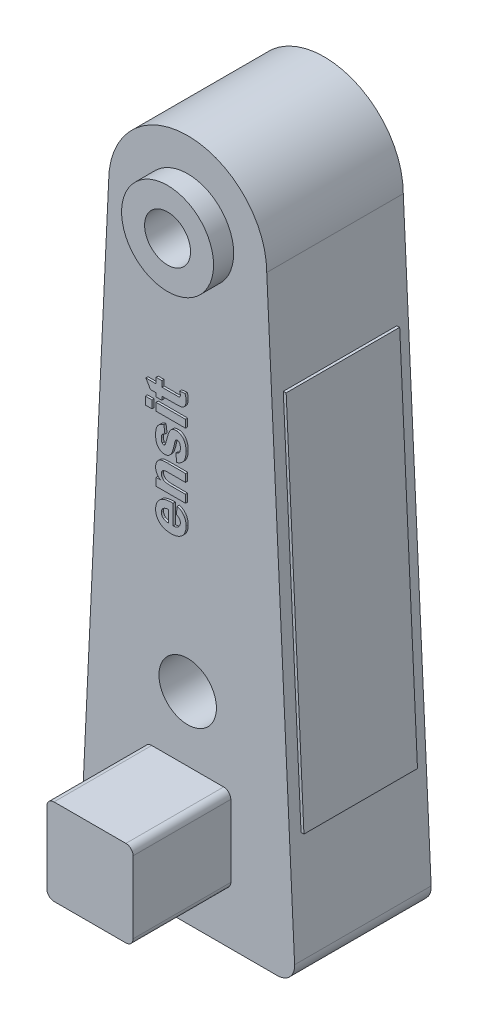
from build123d import *

# Parameters (mm, degrees)
BOSS_EXTRU_1_DEPTH      = 95
ESQUISSE2_R             = 20
ESQUISSE2_R_2           = 16
ENL_V_MAT_EXTRU_1_DEPTH = 357.072448119
BOSS_EXTRU_2_START      = 14
ESQUISSE3_R             = 32
ESQUISSE3_R_2           = 16
BOSS_EXTRU_2_DEPTH      = 14
BOSS_EXTRU_3_DEPTH      = 68
ESQUISSE5_W             = 79
ESQUISSE5_H             = 259.989629167
BOSS_EXTRU_4_DEPTH      = 2
ESQUISSE6_W             = 4.666666667
ESQUISSE6_H             = 5.384615385
ESQUISSE6_W_2           = 20.461538462
BOSS_EXTRU_5_DEPTH      = 1.5


with BuildPart() as part:
    # Esquisse1 → Boss.-Extru.1 (new body)
    with BuildSketch(Plane.XY):
        with BuildLine():
            Line((-62.41497369, -140), (62.41497369, -140))
            ThreePointArc((62.41497369, -140), (71.099712648, -136.281021027), (74.401391343, -127.429218207))
            Line((74.401391343, -127.429218207), (55, 280))
            ThreePointArc((55, 280), (0, 335), (-55, 280))
            Line((-55, 280), (-74.401391343, -127.429218207))
            ThreePointArc((-74.401391343, -127.429218207), (-71.099712648, -136.281021027), (-62.41497369, -140))
        make_face()
    extrude(amount=BOSS_EXTRU_1_DEPTH)

    # Esquisse2 → Enlèv. mat.-Extru.1 (cut, through all)
    with BuildSketch(Plane.XY.offset(95)):
        Circle(ESQUISSE2_R)
        with Locations((0, 280)):
            Circle(ESQUISSE2_R_2)
    extrude(amount=-ENL_V_MAT_EXTRU_1_DEPTH, mode=Mode.SUBTRACT)

    # Esquisse3 → Boss.-Extru.2 (add)
    with BuildSketch(Plane.XY.offset(95).offset(BOSS_EXTRU_2_START)):
        with Locations((0, 280)):
            Circle(ESQUISSE3_R)
        with Locations((0, 280)):
            Circle(ESQUISSE3_R_2, mode=Mode.SUBTRACT)
    extrude(amount=-BOSS_EXTRU_2_DEPTH)

    # Esquisse4 → Boss.-Extru.3 (add)
    with BuildSketch(Plane.XY.offset(95)):
        with BuildLine():
            Line((-25, -105), (25, -105))
            ThreePointArc((25, -105), (28.535533906, -103.535533906), (30, -100))
            Line((30, -100), (30, -50))
            ThreePointArc((30, -50), (28.535533906, -46.464466094), (25, -45))
            Line((25, -45), (-25, -45))
            ThreePointArc((-25, -45), (-28.535533906, -46.464466094), (-30, -50))
            Line((-30, -50), (-30, -100))
            ThreePointArc((-30, -100), (-28.535533906, -103.535533906), (-25, -105))
        make_face()
    extrude(amount=BOSS_EXTRU_3_DEPTH)

    # Esquisse5 → Boss.-Extru.4 (add)
    with BuildSketch(Plane(origin=(68.178733032, 3.246606335, 0), x_dir=(0, 0, -1), z_dir=(0.9988681377244376, 0.04756514941544941, 0))):
        with Locations((-47.5, 73.121548084)):
            Rectangle(ESQUISSE5_W, ESQUISSE5_H)
    extrude(amount=BOSS_EXTRU_4_DEPTH)

    # Esquisse6 → Boss.-Extru.5 (add)
    # profile 1 of 6: a face of its own
    with BuildSketch(Plane.XY.offset(95)):
        with BuildLine():
            Line((-6.461538462, 104.128205128), (-5.743589744, 109.512820513))
            add(Edge.make_bspline(
                [(-5.743589744, 109.512820513), (-5.501006608, 109.424715693), (-5.024036452, 109.251482835), (-4.343564179, 108.935553813), (-3.708516069, 108.579486741), (-3.111635493, 108.19601677), (-2.564328757, 107.7667827), (-2.065430868, 107.297813624), (-1.601117702, 106.800795615), (-1.192712025, 106.258370252), (-0.825760115, 105.683401604), (-0.503719714, 105.073544301), (-0.244762206, 104.421907477), (-0.014437692, 103.744756773), (0.148869701, 103.02781979), (0.274317456, 102.279038677), (0.347697727, 101.493459881), (0.355168117, 100.957415246), (0.358974359, 100.684294872)],
                knots=[0, 0, 0, 0, 1.071107943, 2.106026551, 3.110246261, 4.091985686, 5.048484327, 5.993098568, 6.93243604, 7.868560994, 8.807385201, 9.762150055, 10.726459026, 11.715657284, 12.728568854, 13.774950884, 14.866314096, 16, 16, 16, 16], degree=3))
            add(Edge.make_bspline(
                [(0.358974359, 100.684294872), (0.347561631, 100.257613776), (0.325405615, 99.429279505), (0.173009394, 98.227988636), (-0.106361577, 97.116720063), (-0.477944019, 96.084699741), (-0.972094859, 95.143526998), (-1.562136001, 94.278954402), (-2.274777645, 93.509777825), (-2.821049856, 93.073750879), (-3.096153846, 92.854166667)],
                knots=[0, 0, 0, 0, 1.150789362, 2.234076637, 3.257711293, 4.235652307, 5.185165037, 6.116713503, 7.051572421, 8, 8, 8, 8], degree=3))
            add(Edge.make_bspline(
                [(-3.096153846, 92.854166667), (-3.330681354, 92.69242529), (-3.802951289, 92.366725374), (-4.56819468, 91.961868412), (-5.376592097, 91.615681853), (-6.230459128, 91.339887846), (-7.126551504, 91.110626603), (-8.070562071, 90.956376519), (-9.060509753, 90.867471465), (-9.73512681, 90.853355852), (-10.079326923, 90.846153846)],
                knots=[0, 0, 0, 0, 0.92479112, 1.862259343, 2.806490716, 3.778329015, 4.774107667, 5.808532634, 6.881879269, 8, 8, 8, 8], degree=3))
            add(Edge.make_bspline(
                [(-10.079326923, 90.846153846), (-10.487348705, 90.852068643), (-11.284987436, 90.863631435), (-12.444419657, 91.000834439), (-13.541045657, 91.193863509), (-14.564113096, 91.490786112), (-15.525594941, 91.854675724), (-16.407950297, 92.324255132), (-17.236697824, 92.852182926), (-17.97752343, 93.479223487), (-18.645830859, 94.160164391), (-19.224209579, 94.894324148), (-19.725571493, 95.663711279), (-20.12236037, 96.485735652), (-20.44226999, 97.346302743), (-20.655660284, 98.256767629), (-20.796310841, 99.206619363), (-20.81236088, 99.855516316), (-20.820512821, 100.185096154)],
                knots=[0, 0, 0, 0, 1.22195635, 2.388793332, 3.494217055, 4.554658532, 5.576328032, 6.568651924, 7.544518331, 8.515047117, 9.469844265, 10.399052018, 11.311283086, 12.215791516, 13.128572929, 14.056648418, 15.012956531, 16, 16, 16, 16], degree=3))
            add(Edge.make_bspline(
                [(-20.820512821, 100.185096154), (-20.812715371, 100.553888077), (-20.79745658, 101.275575215), (-20.654212601, 102.32779459), (-20.421213661, 103.321262658), (-20.086439313, 104.252771613), (-19.666537743, 105.128260544), (-19.146561404, 105.941713338), (-18.530273207, 106.690278619), (-17.824380481, 107.380469141), (-17.021181493, 108.001560192), (-16.109209922, 108.527346064), (-15.103063355, 108.971879004), (-13.998123454, 109.330447851), (-12.791665476, 109.595885921), (-11.486517644, 109.777411653), (-10.08289133, 109.880958236), (-9.114752768, 109.874913012), (-8.615384615, 109.871794872)],
                knots=[0, 0, 0, 0, 0.994896733, 1.946908626, 2.859956003, 3.744186721, 4.613079774, 5.475353993, 6.343074053, 7.224463735, 8.134843929, 9.075595858, 10.058286387, 11.098708908, 12.205400254, 13.387874146, 14.652659326, 16, 16, 16, 16], degree=3))
            Line((-8.615384615, 109.871794872), (-8.615384615, 96.230769231))
            add(Edge.make_bspline(
                [(-8.615384615, 96.230769231), (-8.422655443, 96.239599959), (-8.047349924, 96.25679622), (-7.498754662, 96.321934164), (-6.985244151, 96.434699071), (-6.503702991, 96.582271818), (-6.053793278, 96.757750185), (-5.639835272, 96.980972555), (-5.256547966, 97.238153423), (-4.910181652, 97.535470716), (-4.602710213, 97.8610089), (-4.332501073, 98.204524985), (-4.096224632, 98.565491695), (-3.91652132, 98.953234857), (-3.764782142, 99.354863173), (-3.667519517, 99.777606746), (-3.602888703, 100.21863603), (-3.59418527, 100.519523194), (-3.58974359, 100.673076923)],
                knots=[0, 0, 0, 0, 1.231756261, 2.398624542, 3.522625857, 4.583815436, 5.612473245, 6.600564899, 7.580690863, 8.554470542, 9.508734211, 10.435415665, 11.342824763, 12.255949018, 13.158633635, 14.07945191, 15.019874036, 16, 16, 16, 16], degree=3))
            add(Edge.make_bspline(
                [(-3.58974359, 100.673076923), (-3.59897057, 100.877384878), (-3.616841854, 101.273098903), (-3.737723011, 101.84537841), (-3.96305339, 102.360208335), (-4.263180606, 102.832292966), (-4.664698251, 103.248345587), (-5.171003462, 103.603003106), (-5.775665559, 103.907543962), (-6.225391847, 104.052231304), (-6.461538462, 104.128205128)],
                knots=[0, 0, 0, 0, 1.004921032, 1.946382099, 2.856706549, 3.754452914, 4.684394026, 5.679508242, 6.781533818, 8, 8, 8, 8], degree=3))
        make_face()
        with BuildLine():
            add(Edge.make_bspline(
                [(-11.846153846, 104.487179487), (-12.044453586, 104.477919999), (-12.430656174, 104.4598865), (-12.993687781, 104.400905265), (-13.518660513, 104.30021392), (-14.009248228, 104.165536853), (-14.458953883, 103.99237507), (-14.876640828, 103.790205694), (-15.253004646, 103.546688823), (-15.593979345, 103.274744835), (-15.893320848, 102.972683258), (-16.156497645, 102.656741765), (-16.376022372, 102.322565641), (-16.56012553, 101.976462033), (-16.698919426, 101.61052298), (-16.801548866, 101.22937987), (-16.856415468, 100.831698964), (-16.866611715, 100.562915402), (-16.871794872, 100.426282051)],
                knots=[0, 0, 0, 0, 1.316843738, 2.564645129, 3.751729234, 4.859162073, 5.934884982, 6.944432334, 7.931870412, 8.902336615, 9.831997632, 10.748324706, 11.625538792, 12.479920341, 13.343703281, 14.216169456, 15.093208151, 16, 16, 16, 16], degree=3))
            add(Edge.make_bspline(
                [(-16.871794872, 100.426282051), (-16.867055061, 100.280263387), (-16.857715026, 99.992526314), (-16.796773029, 99.570568468), (-16.688681768, 99.170614229), (-16.542385714, 98.789615535), (-16.349729134, 98.428388879), (-16.113459601, 98.086926185), (-15.836535181, 97.763942842), (-15.626734666, 97.569330575), (-15.520032051, 97.470352564)],
                knots=[0, 0, 0, 0, 1.043516863, 2.056302107, 3.038302912, 3.998520634, 4.966791607, 5.956307719, 6.960596886, 8, 8, 8, 8], degree=3))
            add(Edge.make_bspline(
                [(-15.520032051, 97.470352564), (-15.404030882, 97.37809841), (-15.170970074, 97.192748315), (-14.784545983, 96.957669745), (-14.371503886, 96.752899985), (-13.920692054, 96.600302013), (-13.446720326, 96.466290032), (-12.938261367, 96.387679429), (-12.402589622, 96.334723766), (-12.035135588, 96.329043274), (-11.846153846, 96.326121795)],
                knots=[0, 0, 0, 0, 0.903873942, 1.815995408, 2.755131859, 3.711650387, 4.716574161, 5.757841734, 6.846857195, 8, 8, 8, 8], degree=3))
            Line((-11.846153846, 96.326121795), (-11.846153846, 104.487179487))
        make_face(mode=Mode.SUBTRACT)
    # profile 2 of 6: a face of its own
    with BuildSketch(Plane.XY.offset(95)):
        with BuildLine():
            Line((0, 132.128205128), (0, 126.743589744))
            Line((0, 126.743589744), (-10.5, 126.743589744))
            add(Edge.make_bspline(
                [(-10.5, 126.743589744), (-10.765507463, 126.742802233), (-11.272274602, 126.741299133), (-11.995808782, 126.722260708), (-12.644846107, 126.702782443), (-13.220907928, 126.669049557), (-13.722470235, 126.626254977), (-14.153077782, 126.570905504), (-14.509077024, 126.505874818), (-14.880449528, 126.411317264), (-15.272232329, 126.258407347), (-15.682620514, 126.021708207), (-16.045512216, 125.739395428), (-16.341290421, 125.400027044), (-16.581954441, 125.021063241), (-16.749474291, 124.600655066), (-16.854370246, 124.144276441), (-16.865868723, 123.827516364), (-16.871794872, 123.664262821)],
                knots=[0, 0, 0, 0, 1.584493052, 3.024280373, 4.319392181, 5.459488321, 6.467679107, 7.323005985, 8.049570451, 8.626025587, 9.608194156, 10.547930895, 11.445379944, 12.338657376, 13.220996304, 14.11197102, 15.026937278, 16, 16, 16, 16], degree=3))
            add(Edge.make_bspline(
                [(-16.871794872, 123.664262821), (-16.86213041, 123.453945788), (-16.843078352, 123.039336881), (-16.689696256, 122.435216176), (-16.448608326, 121.863851898), (-16.10941893, 121.336354579), (-15.692760055, 120.866394117), (-15.200471906, 120.47527696), (-14.652482824, 120.156519656), (-14.137882602, 119.963465214), (-13.671729421, 119.847438985), (-13.250529875, 119.768698075), (-12.759113188, 119.712222292), (-12.202407332, 119.652598119), (-11.575196301, 119.618959427), (-10.883681247, 119.581427855), (-10.122379198, 119.567609098), (-9.59321361, 119.56530658), (-9.31650641, 119.564102564)],
                knots=[0, 0, 0, 0, 1.032566677, 2.035552408, 3.044331183, 4.069139801, 5.103993993, 6.117241679, 7.146531659, 8.208133594, 8.805465577, 9.506599874, 10.312470975, 11.236026688, 12.25811227, 13.398971111, 14.639889977, 16, 16, 16, 16], degree=3))
            Line((-9.31650641, 119.564102564), (0, 119.564102564))
            Line((0, 119.564102564), (0, 114.179487179))
            Line((0, 114.179487179), (-20.461538462, 114.179487179))
            Line((-20.461538462, 114.179487179), (-20.461538462, 119.564102564))
            Line((-20.461538462, 119.564102564), (-17.511217949, 119.564102564))
            add(Edge.make_bspline(
                [(-17.511217949, 119.564102564), (-17.773571188, 119.772247802), (-18.284659152, 120.177733651), (-18.963025136, 120.85711677), (-19.541399563, 121.573906117), (-20.002409043, 122.341527023), (-20.37537061, 123.141978998), (-20.628736907, 123.988689157), (-20.794894322, 124.873029841), (-20.811872425, 125.477057128), (-20.820512821, 125.784455128)],
                knots=[0, 0, 0, 0, 1.096351489, 2.135792388, 3.138267738, 4.105721302, 5.062255615, 6.023231078, 6.993994435, 8, 8, 8, 8], degree=3))
            add(Edge.make_bspline(
                [(-20.820512821, 125.784455128), (-20.813906022, 126.054244923), (-20.800895316, 126.585539349), (-20.670260563, 127.360966725), (-20.478339698, 128.104611492), (-20.194685853, 128.799115269), (-19.862300766, 129.441916426), (-19.462690954, 129.997982081), (-19.038171972, 130.487187932), (-18.552470151, 130.880896777), (-18.030456476, 131.205860183), (-17.479550392, 131.483480066), (-16.892604508, 131.702278898), (-16.25570326, 131.869427897), (-15.532214565, 131.983587877), (-14.693762576, 132.072997568), (-13.718195988, 132.119575613), (-13.024078164, 132.125203368), (-12.653846154, 132.128205128)],
                knots=[0, 0, 0, 0, 1.087198529, 2.141009522, 3.163542844, 4.178792496, 5.160466844, 6.074805919, 6.934654979, 7.765030839, 8.585173683, 9.411430249, 10.24903402, 11.106896671, 12.062742222, 13.200321845, 14.506693772, 16, 16, 16, 16], degree=3))
            Line((-12.653846154, 132.128205128), (0, 132.128205128))
        make_face()
    # profile 3 of 6: a face of its own
    with BuildSketch(Plane.XY.offset(95)):
        with BuildLine():
            Line((-6.102564103, 135.717948718), (-6.820512821, 141.102564103))
            add(Edge.make_bspline(
                [(-6.820512821, 141.102564103), (-6.569092778, 141.167291309), (-6.084794987, 141.291972072), (-5.426541749, 141.605176652), (-4.860918311, 142.004235511), (-4.392569329, 142.499847615), (-4.026055718, 143.099125241), (-3.77140452, 143.802573816), (-3.612773296, 144.608617665), (-3.59769153, 145.181349247), (-3.58974359, 145.483173077)],
                knots=[0, 0, 0, 0, 1.03977575, 2.002867763, 2.906350581, 3.803237518, 4.719339767, 5.704501652, 6.79029527, 8, 8, 8, 8], degree=3))
            add(Edge.make_bspline(
                [(-3.58974359, 145.483173077), (-3.596539376, 145.812946048), (-3.609315034, 146.432898854), (-3.749299584, 147.296128258), (-3.971173984, 148.040938015), (-4.22263654, 148.452395245), (-4.341346154, 148.646634615)],
                knots=[0, 0, 0, 0, 1.198129151, 2.252408761, 3.175002897, 4, 4, 4, 4], degree=3))
            add(Edge.make_bspline(
                [(-4.341346154, 148.646634615), (-4.431206843, 148.757326627), (-4.605966949, 148.972599267), (-4.957581795, 149.191056108), (-5.343520115, 149.336467224), (-5.61878685, 149.351328142), (-5.760416667, 149.358974359)],
                knots=[0, 0, 0, 0, 1.030872991, 2.004830756, 2.973448591, 4, 4, 4, 4], degree=3))
            add(Edge.make_bspline(
                [(-5.760416667, 149.358974359), (-5.856262429, 149.3553091), (-6.043472585, 149.348149954), (-6.311191282, 149.273237703), (-6.553160424, 149.147504476), (-6.689786774, 149.030877986), (-6.758814103, 148.971955128)],
                knots=[0, 0, 0, 0, 1.045349703, 2.041822997, 3.010676005, 4, 4, 4, 4], degree=3))
            add(Edge.make_bspline(
                [(-6.758814103, 148.971955128), (-6.824173485, 148.886230299), (-6.975623627, 148.687589535), (-7.135578647, 148.284157434), (-7.312037995, 147.771495523), (-7.403964775, 147.380223837), (-7.454326923, 147.165865385)],
                knots=[0, 0, 0, 0, 0.660501868, 1.530508677, 2.647087544, 4, 4, 4, 4], degree=3))
            add(Edge.make_bspline(
                [(-7.454326923, 147.165865385), (-7.568001857, 146.643718121), (-7.784414075, 145.649663902), (-8.128711019, 144.236390075), (-8.461974957, 142.973626517), (-8.786801465, 141.858213919), (-9.100532395, 140.894013878), (-9.417584697, 140.080957466), (-9.713111762, 139.410773098), (-9.94318453, 139.032907768), (-10.045673077, 138.864583333)],
                knots=[0, 0, 0, 0, 1.469089687, 2.796825535, 3.998745421, 5.059265209, 5.990657066, 6.784841839, 7.458693894, 8, 8, 8, 8], degree=3))
            add(Edge.make_bspline(
                [(-10.045673077, 138.864583333), (-10.18564756, 138.67255827), (-10.458942984, 138.297635853), (-10.929522907, 137.798241694), (-11.441171254, 137.374792481), (-11.995470073, 137.028568148), (-12.591092062, 136.764306253), (-13.225272664, 136.571070611), (-13.90069646, 136.459172387), (-14.364176313, 136.443749901), (-14.600160256, 136.435897436)],
                knots=[0, 0, 0, 0, 1.056974227, 2.063706289, 3.045111424, 4.005796011, 4.963194591, 5.937303459, 6.949763919, 8, 8, 8, 8], degree=3))
            add(Edge.make_bspline(
                [(-14.600160256, 136.435897436), (-14.815491005, 136.442765851), (-15.240800558, 136.456331969), (-15.864260371, 136.551680033), (-16.460646091, 136.716372986), (-17.031034171, 136.94792356), (-17.575386261, 137.247170037), (-18.096202993, 137.607889435), (-18.583374417, 138.038442877), (-19.048090319, 138.527038947), (-19.468053274, 139.088336165), (-19.836145162, 139.721339284), (-20.137008984, 140.431694745), (-20.387005979, 141.209070748), (-20.584127653, 142.058871631), (-20.720784359, 142.979775133), (-20.805724897, 143.972761303), (-20.815482121, 144.658474358), (-20.820512821, 145.012019231)],
                knots=[0, 0, 0, 0, 0.866467056, 1.711398476, 2.531025161, 3.351204248, 4.182899032, 5.026153667, 5.89536065, 6.794911284, 7.735444051, 8.709799683, 9.7343434, 10.83365844, 11.992614653, 13.240848695, 14.577416907, 16, 16, 16, 16], degree=3))
            add(Edge.make_bspline(
                [(-20.820512821, 145.012019231), (-20.816509498, 145.348686443), (-20.808738968, 146.002164387), (-20.740513164, 146.947625979), (-20.633046066, 147.827237435), (-20.467002975, 148.637347724), (-20.270382217, 149.38368649), (-20.023118146, 150.064631291), (-19.727069021, 150.674954458), (-19.38630137, 151.225418466), (-18.993213376, 151.713395864), (-18.566434765, 152.167060389), (-18.090012126, 152.576133245), (-17.577305107, 152.95602244), (-17.009330414, 153.277119447), (-16.408008871, 153.57200756), (-15.760795931, 153.825662823), (-15.308019319, 153.958063828), (-15.076923077, 154.025641026)],
                knots=[0, 0, 0, 0, 1.380360088, 2.679307166, 3.885113103, 5.011294146, 6.067668824, 7.047577368, 7.976808132, 8.844746588, 9.6960693, 10.542058856, 11.395278188, 12.26784334, 13.154143679, 14.066232085, 15.013008876, 16, 16, 16, 16], degree=3))
            Line((-15.076923077, 154.025641026), (-14.358974359, 148.641025641))
            add(Edge.make_bspline(
                [(-14.358974359, 148.641025641), (-14.552047053, 148.587677071), (-14.926852522, 148.484113303), (-15.434568038, 148.22615665), (-15.87626475, 147.910301821), (-16.243125527, 147.522025762), (-16.533014556, 147.05225252), (-16.728739725, 146.494019804), (-16.854738417, 145.851480986), (-16.86589524, 145.394101762), (-16.871794872, 145.15224359)],
                knots=[0, 0, 0, 0, 1.018088462, 1.976380579, 2.883123771, 3.772444965, 4.678988082, 5.673279403, 6.769650299, 8, 8, 8, 8], degree=3))
            add(Edge.make_bspline(
                [(-16.871794872, 145.15224359), (-16.864400999, 144.852669733), (-16.850667362, 144.29623084), (-16.749715279, 143.529342043), (-16.576789704, 142.890025628), (-16.379066262, 142.541238398), (-16.288461538, 142.381410256)],
                knots=[0, 0, 0, 0, 1.253094045, 2.327540427, 3.233612691, 4, 4, 4, 4], degree=3))
            add(Edge.make_bspline(
                [(-16.288461538, 142.381410256), (-16.217521119, 142.29511266), (-16.081390467, 142.129512454), (-15.817582577, 141.950725243), (-15.525231463, 141.837166465), (-15.317289639, 141.826127044), (-15.211538462, 141.820512821)],
                knots=[0, 0, 0, 0, 1.057832138, 2.029920023, 2.998093444, 4, 4, 4, 4], degree=3))
            add(Edge.make_bspline(
                [(-15.211538462, 141.820512821), (-15.120949105, 141.827336144), (-14.940275072, 141.840944779), (-14.680901039, 141.941376946), (-14.443744645, 142.10907445), (-14.318171788, 142.262035245), (-14.252403846, 142.342147436)],
                knots=[0, 0, 0, 0, 0.958252903, 1.911167308, 2.905987877, 4, 4, 4, 4], degree=3))
            add(Edge.make_bspline(
                [(-14.252403846, 142.342147436), (-14.203592579, 142.417689951), (-14.086974952, 142.598172642), (-13.945594958, 142.945727771), (-13.7825968, 143.396878571), (-13.606695462, 143.957536762), (-13.408077872, 144.623436129), (-13.210372338, 145.401707441), (-12.991249209, 146.285975987), (-12.764874451, 147.250593421), (-12.532555629, 148.232771445), (-12.268074372, 149.161972838), (-11.994116648, 150.014323763), (-11.705116212, 150.786075037), (-11.400459709, 151.480183985), (-11.090662319, 152.098165339), (-10.762025537, 152.638206661), (-10.512472674, 152.950965961), (-10.393429487, 153.100160256)],
                knots=[0, 0, 0, 0, 0.374470902, 0.894668607, 1.558240068, 2.377002728, 3.344280683, 4.45643205, 5.72551034, 7.144099038, 8.589083829, 9.934452683, 11.172410737, 12.322411392, 13.369942356, 14.332493707, 15.20455626, 16, 16, 16, 16], degree=3))
            add(Edge.make_bspline(
                [(-10.393429487, 153.100160256), (-10.271486206, 153.232688475), (-10.030535251, 153.494554487), (-9.612165948, 153.824331642), (-9.169499017, 154.116673964), (-8.683759373, 154.343020145), (-8.167673967, 154.525555159), (-7.61495981, 154.654908363), (-7.026114431, 154.725033143), (-6.622502661, 154.737322404), (-6.416666667, 154.743589744)],
                knots=[0, 0, 0, 0, 0.971012965, 1.9186502, 2.868006896, 3.82989672, 4.803792202, 5.820095146, 6.888280979, 8, 8, 8, 8], degree=3))
            add(Edge.make_bspline(
                [(-6.416666667, 154.743589744), (-6.188212069, 154.735238584), (-5.738160138, 154.718786932), (-5.074207049, 154.612180375), (-4.438544333, 154.422382972), (-3.821542712, 154.172644029), (-3.235191915, 153.835590992), (-2.673840019, 153.428665018), (-2.13092088, 152.955679575), (-1.62151804, 152.406332807), (-1.156320253, 151.782802929), (-0.744247904, 151.090996541), (-0.402345981, 150.325778653), (-0.122387817, 149.491514028), (0.093628857, 148.586448721), (0.251222169, 147.611790378), (0.337793686, 146.567274898), (0.351775999, 145.847907864), (0.358974359, 145.477564103)],
                knots=[0, 0, 0, 0, 0.853005228, 1.680406763, 2.502135431, 3.325285981, 4.159928718, 5.020072903, 5.910500533, 6.844018396, 7.811498054, 8.809909951, 9.84399402, 10.934451331, 12.090792638, 13.314110396, 14.617253208, 16, 16, 16, 16], degree=3))
            add(Edge.make_bspline(
                [(0.358974359, 145.477564103), (0.353097399, 145.139053993), (0.341651721, 144.479788317), (0.267168101, 143.517621426), (0.121110506, 142.612633603), (-0.055827924, 141.75652162), (-0.306230076, 140.959002993), (-0.602718172, 140.212711394), (-0.955427583, 139.520128683), (-1.366694746, 138.885600877), (-1.823632776, 138.305879297), (-2.318515608, 137.77610599), (-2.851366045, 137.298995835), (-3.423149262, 136.87330165), (-4.036588489, 136.50375697), (-4.687329243, 136.18397252), (-5.377874415, 135.916081062), (-5.858174063, 135.784765691), (-6.102564103, 135.717948718)],
                knots=[0, 0, 0, 0, 1.275882977, 2.484847063, 3.632911253, 4.72891361, 5.776434669, 6.778732445, 7.752511816, 8.700454148, 9.62377315, 10.531089817, 11.429331714, 12.315777555, 13.213660083, 14.124390551, 15.045636884, 16, 16, 16, 16], degree=3))
        make_face()
    # profile 4 of 6: a face of its own
    with BuildSketch(Plane.XY.offset(95)):
        with Locations((-25.666666666, 162.102564103)):
            Rectangle(ESQUISSE6_W, ESQUISSE6_H)
    # profile 5 of 6: a face of its own
    with BuildSketch(Plane.XY.offset(95)):
        with Locations((-10.230769231, 162.102564103)):
            Rectangle(ESQUISSE6_W_2, ESQUISSE6_H)
    # profile 6 of 6: a face of its own
    with BuildSketch(Plane.XY.offset(95)):
        with BuildLine():
            Line((-20.461538462, 179.871794872), (-16.512820513, 179.871794872))
            Line((-16.512820513, 179.871794872), (-16.512820513, 175.923076923))
            Line((-16.512820513, 175.923076923), (-7.717948718, 175.923076923))
            add(Edge.make_bspline(
                [(-7.717948718, 175.923076923), (-7.506676804, 175.922666092), (-7.108429247, 175.921891676), (-6.54561709, 175.926986284), (-6.052044348, 175.938886062), (-5.627711855, 175.951413786), (-5.273839086, 175.957259929), (-4.99169917, 175.982133779), (-4.778485338, 176.003707237), (-4.512404737, 176.038676636), (-4.187946772, 176.190559461), (-3.915701574, 176.460056098), (-3.744474482, 176.721882388), (-3.656291933, 176.951532495), (-3.597271659, 177.198929248), (-3.592288495, 177.371701159), (-3.58974359, 177.459935897)],
                knots=[0, 0, 0, 0, 1.77315728, 3.34240147, 4.723623899, 5.916602724, 6.905675159, 7.692764687, 8.292342073, 8.70512513, 9.941484344, 11.206586204, 11.8769341, 12.552951387, 13.260991239, 14, 14, 14, 14], degree=3))
            add(Edge.make_bspline(
                [(-3.58974359, 177.459935897), (-3.59790553, 177.604250626), (-3.615954518, 177.92338245), (-3.719652653, 178.441169585), (-3.884684158, 179.041285563), (-4.028560294, 179.46495301), (-4.105769231, 179.692307692)],
                knots=[0, 0, 0, 0, 0.753421026, 1.666085143, 2.747540144, 4, 4, 4, 4], degree=3))
            Line((-4.105769231, 179.692307692), (-0.353365385, 180.230769231))
            add(Edge.make_bspline(
                [(-0.353365385, 180.230769231), (-0.241188492, 179.903782785), (-0.012990561, 179.238604526), (0.194620796, 178.179086978), (0.33563488, 177.061812156), (0.351072833, 176.293752786), (0.358974359, 175.900641026)],
                knots=[0, 0, 0, 0, 0.939547081, 1.911291127, 2.930947196, 4, 4, 4, 4], degree=3))
            add(Edge.make_bspline(
                [(0.358974359, 175.900641026), (0.351800641, 175.659206991), (0.337791769, 175.187733429), (0.248993296, 174.497344522), (0.091556762, 173.845246536), (-0.125476871, 173.236179984), (-0.392044984, 172.685989139), (-0.69169444, 172.201885845), (-1.039792907, 171.802141333), (-1.429249439, 171.473877409), (-1.874432039, 171.211554276), (-2.37954042, 171.001237405), (-2.949917778, 170.824092647), (-3.358713814, 170.750763232), (-3.572916667, 170.712339744)],
                knots=[0, 0, 0, 0, 1.203161335, 2.349539328, 3.461321991, 4.539895401, 5.564950711, 6.503172023, 7.368227033, 8.19490246, 9.030559212, 9.932169365, 10.916488464, 12, 12, 12, 12], degree=3))
            add(Edge.make_bspline(
                [(-3.572916667, 170.712339744), (-3.662605719, 170.698893872), (-3.86214876, 170.668979073), (-4.192785519, 170.62839112), (-4.586056803, 170.603346743), (-5.04055464, 170.582823759), (-5.556375104, 170.556497941), (-6.13250935, 170.550931971), (-6.769960097, 170.534822756), (-7.214997301, 170.537208575), (-7.448717949, 170.538461538)],
                knots=[0, 0, 0, 0, 0.560521704, 1.24706641, 2.057998689, 2.995119087, 4.059211621, 5.249632546, 6.555586685, 8, 8, 8, 8], degree=3))
            Line((-7.448717949, 170.538461538), (-16.512820513, 170.538461538))
            Line((-16.512820513, 170.538461538), (-16.512820513, 168.025641026))
            Line((-16.512820513, 168.025641026), (-20.461538462, 168.025641026))
            Line((-20.461538462, 168.025641026), (-20.461538462, 170.538461538))
            Line((-20.461538462, 170.538461538), (-24.41025641, 170.538461538))
            Line((-24.41025641, 170.538461538), (-27.641025641, 175.923076923))
            Line((-27.641025641, 175.923076923), (-20.461538462, 175.923076923))
            Line((-20.461538462, 175.923076923), (-20.461538462, 179.871794872))
        make_face()
    extrude(amount=BOSS_EXTRU_5_DEPTH)


solid = part.part
